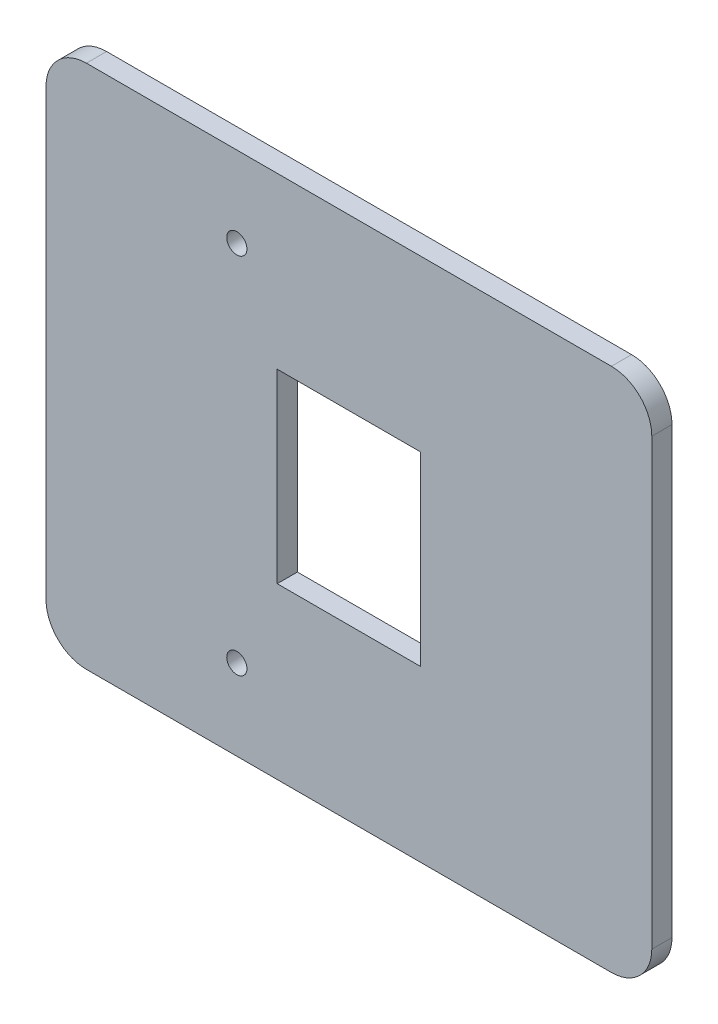
from build123d import *

# Parameters (mm, degrees)
SKETCH_3_W          = 150
SKETCH_3_H          = 130
EXTRUDE_1_DEPTH     = 5
SKETCH_4_W          = 35.5
SKETCH_4_H          = 46
SKETCH_4_R          = 2.5
CUT_EXTRUDE_1_DEPTH = 10
FILLET_1_R          = 10


with BuildPart() as part:
    # 草图3 → 凸台-拉伸1 (new body)
    with BuildSketch(Plane.XY):
        Rectangle(SKETCH_3_W, SKETCH_3_H)
    extrude(amount=EXTRUDE_1_DEPTH)

    # 草图4 → 切除-拉伸1 (cut)
    with BuildSketch(Plane.XY.offset(5)):
        Rectangle(SKETCH_4_W, SKETCH_4_H)
        with Locations((-27.75, -45)):
            Circle(SKETCH_4_R)
        with Locations((-27.75, 45)):
            Circle(SKETCH_4_R)
    extrude(amount=-CUT_EXTRUDE_1_DEPTH, mode=Mode.SUBTRACT)

    # 圆角1
    fillet_1_edges = [part.edges().sort_by_distance(p)[0] for p in [
        (75, -65, 2.5),
        (-75, -65, 2.5),
        (-75, 65, 2.5),
        (75, 65, 2.5),
    ]]
    fillet(fillet_1_edges, radius=FILLET_1_R)


solid = part.part
